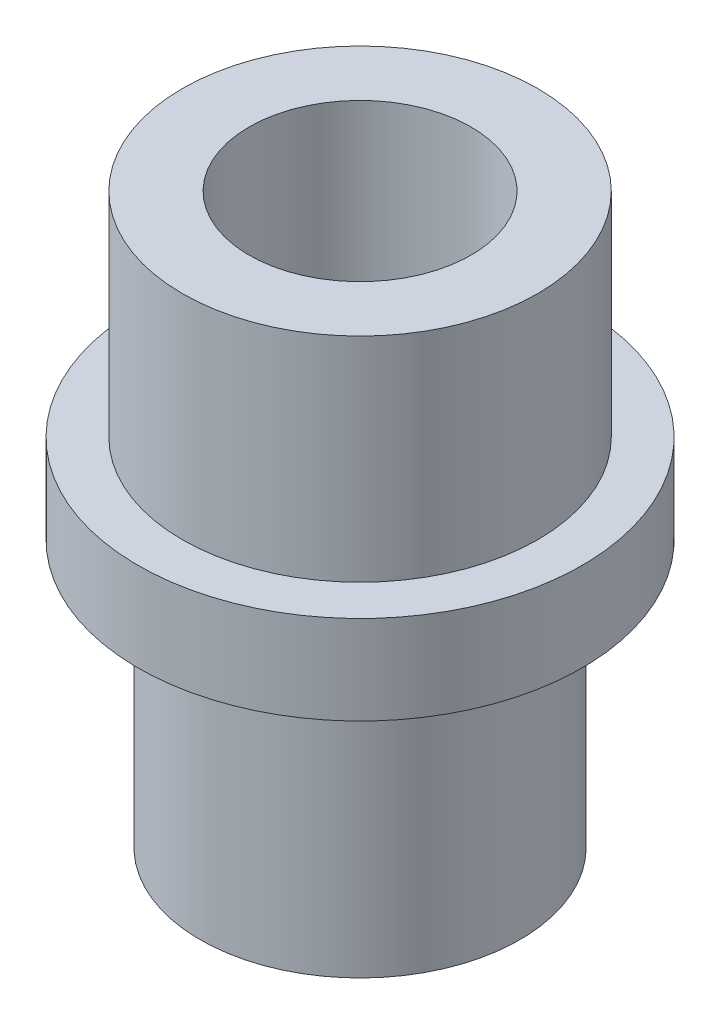
from build123d import *


with BuildPart() as part:
    # 草图1 → 旋转1 (revolve)
    with BuildSketch(Plane.XY, mode=Mode.PRIVATE) as revolve_1_sk:
        Polygon((1, 0), (1.8, 0), (1.8, 3), (2.5, 3), (2.5, 4), (2, 4), (2, 6.4), (1.25, 6.4), (1.25, 2.4), (0, 2.4), (0, 0.5), (1, 0.5), align=None)
    revolve(revolve_1_sk.sketch.rotate(Axis((0, 13.910026484, 0), (0, -1, 0)), 180), axis=Axis((0, 13.910026484, 0), (0, -1, 0)))


solid = part.part
